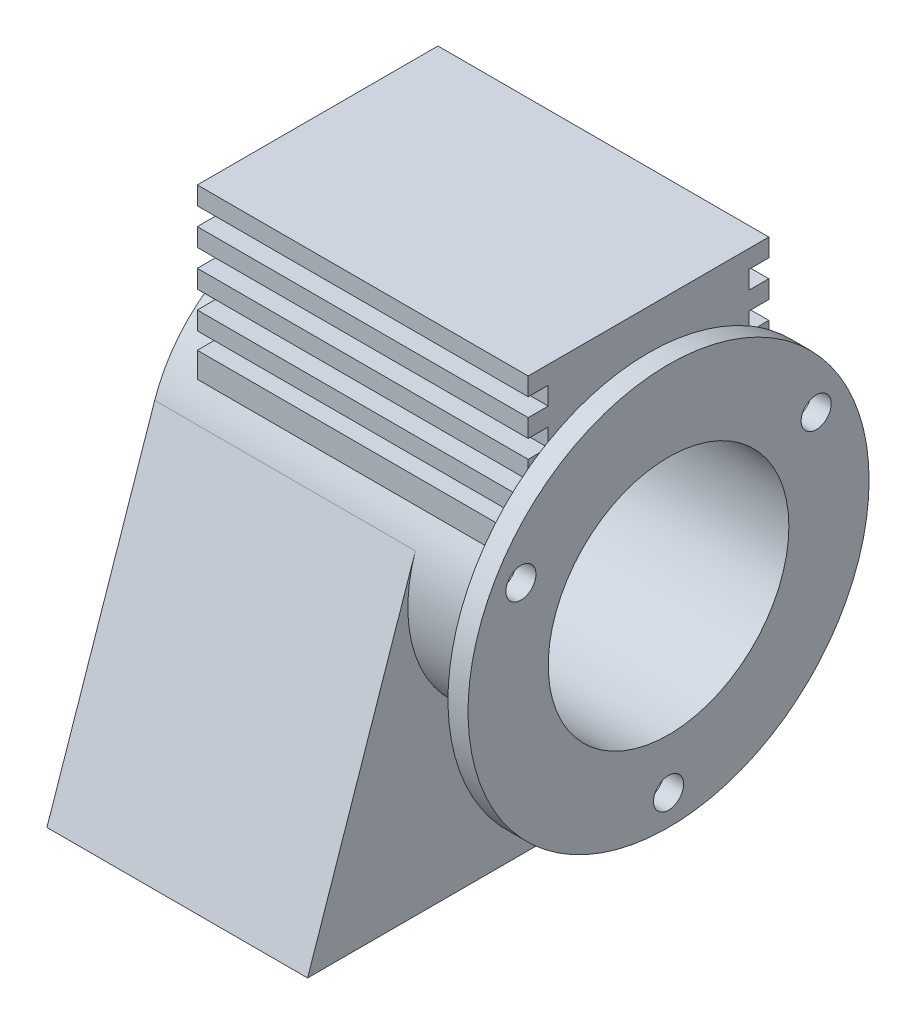
from build123d import *

# Parameters (mm, degrees)
BOSS_EXTRUDE1_DEPTH = 165.1
BOSS_EXTRUDE2_START = 63.5
SKETCH3_R           = 88.9
SKETCH3_R_2         = 16.51
BOSS_EXTRUDE2_DEPTH = 63.5
BOSS_EXTRUDE3_START = 63.5
BOSS_EXTRUDE3_DEPTH = 209.55
SKETCH7_R           = 127
SKETCH7_R_2         = 9.525
BOSS_EXTRUDE4_DEPTH = 12.7
SKETCH8_R           = 76.2
CUT_EXTRUDE1_DEPTH  = 228.6


with BuildPart() as part:
    # Sketch2 → Boss-Extrude1 (new body)
    with BuildSketch(Plane(origin=(0, 0, 0), x_dir=(0, 0, -1), z_dir=(1, 0, 0))):
        with BuildLine():
            Line((-84.14126771, 28.695941668), (-152.4, -171.45))
            Line((-152.4, -171.45), (0, -171.45))
            Line((0, -171.45), (0, -88.9))
            ThreePointArc((0, -88.9), (-72.298959931, -51.730749007), (-84.14126771, 28.695941668))
        make_face()
        with BuildLine():
            Line((0, -88.9), (0, -171.45))
            Line((0, -171.45), (152.4, -171.45))
            Line((152.4, -171.45), (84.14126771, 28.695941668))
            ThreePointArc((84.14126771, 28.695941668), (87.702248259, 14.543921421), (88.9, 0))
            ThreePointArc((88.9, 0), (62.861792847, -62.861792847), (0, -88.9))
        make_face()
        with BuildLine():
            ThreePointArc((0, 88.9), (-51.730749007, 72.298959931), (-84.14126771, 28.695941668))
            ThreePointArc((-84.14126771, 28.695941668), (-72.298959931, -51.730749007), (0, -88.9))
            Line((0, -88.9), (0, -19.05))
            ThreePointArc((0, -19.05), (-19.05, 0), (0, 19.05))
            Line((0, 19.05), (0, 88.9))
        make_face()
        with BuildLine():
            Line((0, -19.05), (0, -88.9))
            ThreePointArc((0, -88.9), (62.861792847, -62.861792847), (88.9, 0))
            ThreePointArc((88.9, 0), (87.702248259, 14.543921421), (84.14126771, 28.695941668))
            ThreePointArc((84.14126771, 28.695941668), (51.730749007, 72.298959931), (0, 88.9))
            Line((0, 88.9), (0, 19.05))
            ThreePointArc((0, 19.05), (13.470384182, 13.470384182), (19.05, 0))
            ThreePointArc((19.05, 0), (13.470384182, -13.470384182), (0, -19.05))
        make_face()
    extrude(amount=-BOSS_EXTRUDE1_DEPTH)

    # Sketch3 → Boss-Extrude2 (add)
    with BuildSketch(Plane(origin=(0, 0, 0), x_dir=(0, 0, -1), z_dir=(1, 0, 0)).offset(BOSS_EXTRUDE2_START)):
        Circle(SKETCH3_R)
        Circle(SKETCH3_R_2, mode=Mode.SUBTRACT)
    extrude(amount=-BOSS_EXTRUDE2_DEPTH)

    # Sketch6 → Boss-Extrude3 (add)
    with BuildSketch(Plane(origin=(0, 0, 0), x_dir=(0, 0, -1), z_dir=(1, 0, 0)).offset(BOSS_EXTRUDE3_START)):
        Polygon((76.2, 152.4), (-76.2, 152.4), (-76.2, 140.97), (-63.5, 140.97), (-63.5, 129.54), (-76.2, 129.54), (-76.2, 118.11), (-63.5, 118.11), (-63.5, 106.68), (-76.2, 106.68), (-76.2, 95.25), (-63.5, 95.25), (-63.5, 83.82), (-76.2, 83.82), (-76.2, 72.39), (-63.5, 72.39), (-63.5, 61.722), (-76.2, 61.722), (-76.2, 0), (76.2, 0), (76.2, 61.722), (63.5, 61.722), (63.5, 72.39), (76.2, 72.39), (76.2, 83.82), (63.5, 83.82), (63.5, 95.25), (76.2, 95.25), (76.2, 106.68), (63.5, 106.68), (63.5, 118.11), (76.2, 118.11), (76.2, 129.54), (63.5, 129.54), (63.5, 140.97), (76.2, 140.97), align=None)
    extrude(amount=-BOSS_EXTRUDE3_DEPTH)

    # Sketch7 → Boss-Extrude4 (add)
    with BuildSketch(Plane(origin=(63.5, 0, 0), x_dir=(0, 0, -1), z_dir=(1, 0, 0))):
        with Locations(Location((0, 0, 0), (0, 0, 126.869897646))):
            Circle(SKETCH7_R)
        with Locations((0, -107.95)):
            Circle(SKETCH7_R_2, mode=Mode.SUBTRACT)
        with Locations((-93.487442339, 53.975)):
            Circle(SKETCH7_R_2, mode=Mode.SUBTRACT)
        with Locations((93.487442339, 53.975)):
            Circle(SKETCH7_R_2, mode=Mode.SUBTRACT)
    extrude(amount=BOSS_EXTRUDE4_DEPTH)

    # Sketch8 → Cut-Extrude1 (cut)
    with BuildSketch(Plane(origin=(76.2, 0, 0), x_dir=(0, 0, -1), z_dir=(1, 0, 0))):
        Circle(SKETCH8_R)
    extrude(amount=-CUT_EXTRUDE1_DEPTH, mode=Mode.SUBTRACT)


solid = part.part
